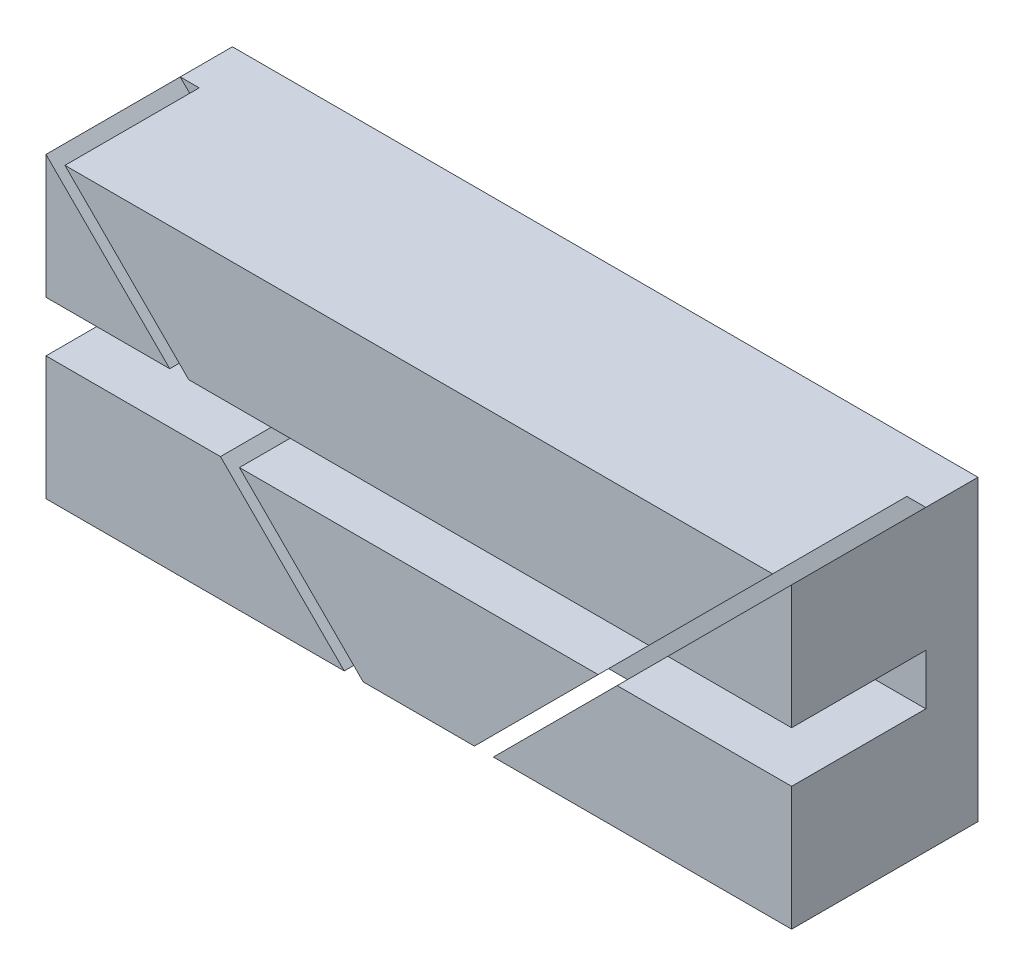
from build123d import *

# Parameters (mm, degrees)
BOSS_EXTRUDE1_DEPTH = 31.75
CUT_EXTRUDE1_DEPTH  = 22.86


with BuildPart() as part:
    # Sketch1 → Boss-Extrude1 (new body)
    with BuildSketch(Plane.XY):
        Polygon((63.5, -4.318), (33.782, -4.318), (12.7, -25.4), (63.5, -25.4), align=None)
        Polygon((9.467107796, -25.4), (30.549107796, -4.318), (-30.549107796, -4.318), (-9.467107796, -25.4), align=None)
        Polygon((-12.7, -25.4), (-33.782, -4.318), (-63.5, -4.318), (-63.5, -25.4), align=None)
        Polygon((12.7, -25.4), (33.782, -4.318), (30.549107796, -4.318), (9.467107796, -25.4), align=None)
        Polygon((-9.467107796, -25.4), (-30.549107796, -4.318), (-33.782, -4.318), (-12.7, -25.4), align=None)
        Polygon((39.185107796, 4.318), (60.267107796, 25.4), (-60.267107796, 25.4), (-39.185107796, 4.318), align=None)
        Polygon((30.549107796, -4.318), (39.185107796, 4.318), (-39.185107796, 4.318), (-30.549107796, -4.318), align=None)
        Polygon((63.5, 4.318), (63.5, 25.4), (42.418, 4.318), align=None)
        Polygon((63.5, 4.318), (42.418, 4.318), (33.782, -4.318), (63.5, -4.318), align=None)
        Polygon((33.782, -4.318), (42.418, 4.318), (39.185107796, 4.318), (30.549107796, -4.318), align=None)
        Polygon((42.418, 4.318), (63.5, 25.4), (60.267107796, 25.4), (39.185107796, 4.318), align=None)
        Polygon((-42.418, 4.318), (-63.5, 25.4), (-63.5, 4.318), align=None)
        Polygon((-39.185107796, 4.318), (-60.267107796, 25.4), (-63.5, 25.4), (-42.418, 4.318), align=None)
        Polygon((-33.782, -4.318), (-42.418, 4.318), (-63.5, 4.318), (-63.5, -4.318), align=None)
        Polygon((-30.549107796, -4.318), (-39.185107796, 4.318), (-42.418, 4.318), (-33.782, -4.318), align=None)
    extrude(amount=BOSS_EXTRUDE1_DEPTH)

    # Sketch2 → Cut-Extrude1 (cut)
    with BuildSketch(Plane.XY.offset(31.75)):
        Polygon((63.5, 25.4), (60.267107796, 25.4), (39.185107796, 4.318), (42.418, 4.318), align=None)
        Polygon((42.418, 4.318), (39.185107796, 4.318), (30.549107796, -4.318), (33.782, -4.318), align=None)
        Polygon((33.782, -4.318), (30.549107796, -4.318), (9.467107796, -25.4), (12.7, -25.4), align=None)
        Polygon((30.549107796, -4.318), (39.185107796, 4.318), (-39.185107796, 4.318), (-30.549107796, -4.318), align=None)
        Polygon((63.5, 4.318), (42.418, 4.318), (33.782, -4.318), (63.5, -4.318), align=None)
        Polygon((-9.467107796, -25.4), (-30.549107796, -4.318), (-33.782, -4.318), (-12.7, -25.4), align=None)
        Polygon((-30.549107796, -4.318), (-39.185107796, 4.318), (-42.418, 4.318), (-33.782, -4.318), align=None)
        Polygon((-39.185107796, 4.318), (-60.267107796, 25.4), (-63.5, 25.4), (-42.418, 4.318), align=None)
        Polygon((-33.782, -4.318), (-42.418, 4.318), (-63.5, 4.318), (-63.5, -4.318), align=None)
    extrude(amount=-CUT_EXTRUDE1_DEPTH, mode=Mode.SUBTRACT)


solid = part.part
